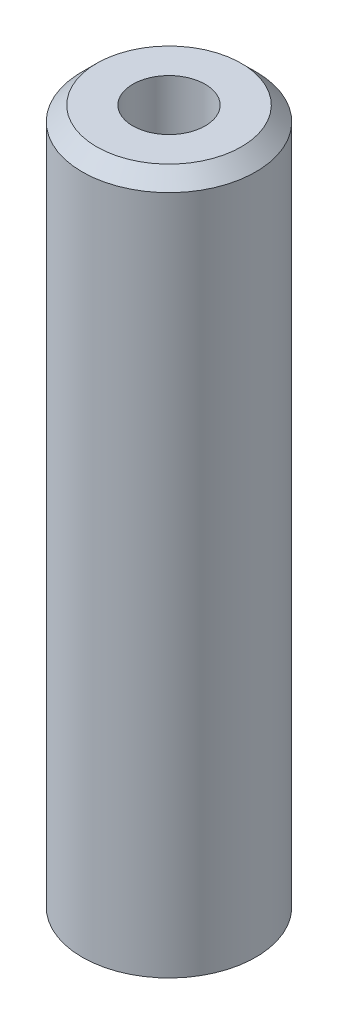
from build123d import *

# Parameters (mm, degrees)
TALADRO_ROSCADO_M61_D     = 5
TALADRO_ROSCADO_M61_DEPTH = 10
TALADRO_ROSCADO_M61_TIP   = 1.502151548


with BuildPart() as part:
    # Croquis1 → Revolución1 (revolve)
    with BuildSketch(Plane.XY, mode=Mode.PRIVATE) as revoluci_n1_sk:
        Polygon((0, 48), (0, 0), (6, 0), (6, 47), (5, 48), align=None)
    revolve(revoluci_n1_sk.sketch.rotate(Axis((0, 48, 0), (0, -1, 0)), 90), axis=Axis((0, 48, 0), (0, -1, 0)))

    # Taladro roscado M61
    with Locations(Plane(origin=(0, 48, 0), x_dir=(1, 0, 0), z_dir=(0, 1, 0))):
        with Locations((0, 0)):
            Hole(TALADRO_ROSCADO_M61_D / 2, depth=TALADRO_ROSCADO_M61_DEPTH)
            with Locations((0, 0, -(TALADRO_ROSCADO_M61_DEPTH + TALADRO_ROSCADO_M61_TIP / 2))):  # 118° drill point
                Cone(0, TALADRO_ROSCADO_M61_D / 2, TALADRO_ROSCADO_M61_TIP, mode=Mode.SUBTRACT)


solid = part.part
